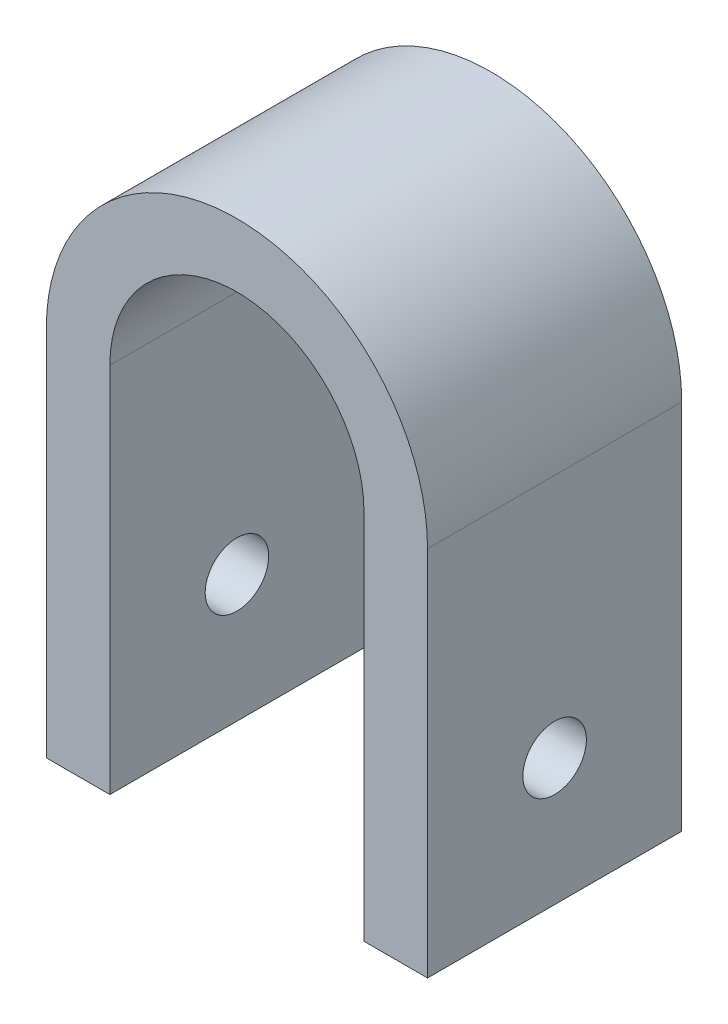
from build123d import *

# Parameters (mm, degrees)
BOSS_EXTRUDE1_DEPTH = 8
SKETCH2_R           = 1
CUT_EXTRUDE1_DEPTH  = 19.572175383


with BuildPart() as part:
    # Sketch1 → Boss-Extrude1 (new body)
    with BuildSketch(Plane.XY):
        with BuildLine():
            Line((-4, 0), (-4, -11.701525476))
            Line((-4, -11.701525476), (-6, -11.701525476))
            Line((-6, -11.701525476), (-6, 0))
            ThreePointArc((-6, 0), (0, 6), (6, 0))
            Line((6, 0), (6, -11.701525476))
            Line((6, -11.701525476), (3.999999999, -11.701525476))
            Line((3.999999999, -11.701525476), (4, 0))
            ThreePointArc((4, 0), (0, 4), (-4, 0))
        make_face()
    extrude(amount=BOSS_EXTRUDE1_DEPTH)

    # Sketch2 → Cut-Extrude1 (cut, through all)
    with BuildSketch(Plane.ZY.offset(6)):
        with Locations((4, -7.701525476)):
            Circle(SKETCH2_R)
    extrude(amount=-CUT_EXTRUDE1_DEPTH, mode=Mode.SUBTRACT)


solid = part.part
